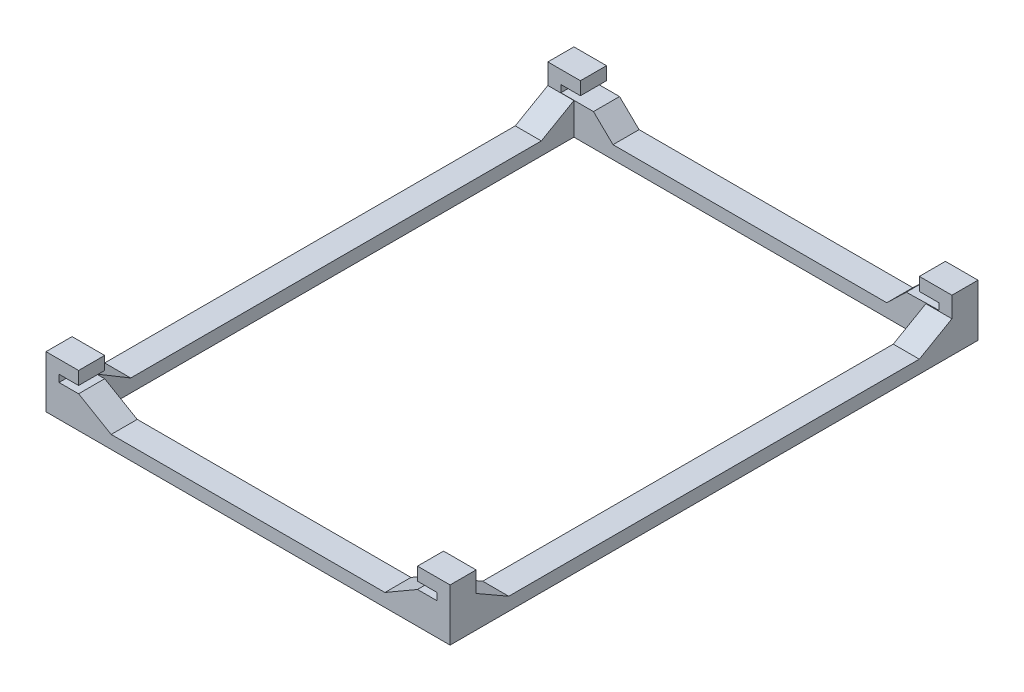
from build123d import *

# Parameters (mm, degrees)
SKETCH_1_W      = 62
SKETCH_1_H      = 81
SKETCH_1_W_2    = 54
SKETCH_1_H_2    = 73
EXTRUDE_1_DEPTH = 2
EXTRUDE_2_DEPTH = 4
EXTRUDE_3_DEPTH = 4
EXTRUDE_4_DEPTH = 4
EXTRUDE_5_DEPTH = 4
EXTRUDE_6_DEPTH = 4
EXTRUDE_7_DEPTH = 4
EXTRUDE_8_DEPTH = 4
EXTRUDE_9_DEPTH = 4


with BuildPart() as part:
    # Эскиз1 → Бобышка-Вытянуть1 (new body)
    with BuildSketch(Plane(origin=(0, 0, 0), x_dir=(1, 0, 0), z_dir=(0, 1, 0))):
        Rectangle(SKETCH_1_W, SKETCH_1_H)
        Rectangle(SKETCH_1_W_2, SKETCH_1_H_2, mode=Mode.SUBTRACT)
    extrude(amount=EXTRUDE_1_DEPTH)

    # Эскиз6 → Бобышка-Вытянуть2 (add)
    with BuildSketch(Plane.XY.offset(40.5)):
        Polygon((26, 2), (31, 2), (31, 8), (26, 8), (26, 6), (29, 6), (29, 4.9), (26, 4.9), align=None)
        Polygon((21, 2), (26, 2), (26, 4.9), align=None)
    extrude(amount=-EXTRUDE_2_DEPTH)

    # Эскиз8 → Бобышка-Вытянуть3 (add)
    with BuildSketch(Plane.XY.offset(40.5)):
        Polygon((-31, 8), (-31, 2), (-26, 2), (-26, 4.9), (-29, 4.9), (-29, 6), (-26, 6), (-26, 8), align=None)
        Polygon((-26, 4.9), (-26, 2), (-21, 2), align=None)
    extrude(amount=-EXTRUDE_3_DEPTH)

    # Эскиз10 → Бобышка-Вытянуть4 (add)
    with BuildSketch(Plane(origin=(0, 0, -40.5), x_dir=(-1, 0, 0), z_dir=(0, 0, -1))):
        Polygon((-31, 8), (-31, 2), (-24, 2), (-24, 4.9), (-29, 5), (-29, 6), (-26, 6), (-26, 8), align=None)
        Polygon((-24, 4.9), (-24, 2), (-21, 2), align=None)
    extrude(amount=-EXTRUDE_4_DEPTH)

    # Эскиз11 → Бобышка-Вытянуть5 (add)
    with BuildSketch(Plane(origin=(0, 0, -40.5), x_dir=(-1, 0, 0), z_dir=(0, 0, -1))):
        Polygon((24, 2), (31, 2), (31, 8), (26, 8), (26, 6), (29, 6), (29, 4.9), (24, 4.9), align=None)
        Polygon((21, 2), (24, 2), (24, 4.9), align=None)
    extrude(amount=-EXTRUDE_5_DEPTH)

    # Эскиз12 → Бобышка-Вытянуть6 (add)
    with BuildSketch(Plane.ZY.offset(31)):
        Polygon((-36.5, 2), (-31.5, 2), (-36.5, 4.866692533), align=None)
    extrude(amount=-EXTRUDE_6_DEPTH)

    # Эскиз13 → Бобышка-Вытянуть7 (add)
    with BuildSketch(Plane.ZY.offset(31)):
        Polygon((36.5, 2), (36.5, 5), (31.5, 2), align=None)
    extrude(amount=-EXTRUDE_7_DEPTH)

    # Эскиз17 → Бобышка-Вытянуть8 (add)
    with BuildSketch(Plane(origin=(31, 0, 0), x_dir=(0, 0, -1), z_dir=(1, 0, 0))):
        Polygon((-31.5, 2), (-36.5, 4.867780804), (-36.5, 2), align=None)
    extrude(amount=-EXTRUDE_8_DEPTH)

    # Эскиз21 → Бобышка-Вытянуть9 (add)
    with BuildSketch(Plane(origin=(31, 0, 0), x_dir=(0, 0, -1), z_dir=(1, 0, 0))):
        Polygon((36.5, 2), (36.5, 4.866692533), (31.5, 2), align=None)
    extrude(amount=-EXTRUDE_9_DEPTH)


solid = part.part
